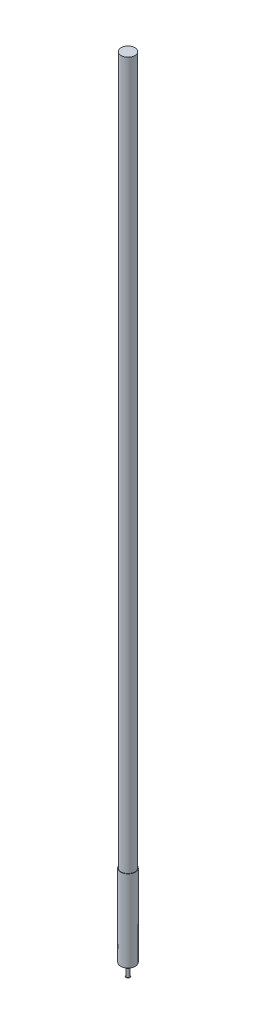
from build123d import *


with BuildPart() as part:
    # Sketch2 → Revolve1 (revolve)
    with BuildSketch(Plane(origin=(0, 0, 0), x_dir=(0, 0, -1), z_dir=(1, 0, 0)), mode=Mode.PRIVATE) as revolve1_sk:
        with BuildLine():
            Line((0.925, -4.438709677), (0.925, 5.95))
            Line((0.925, 5.95), (0.875, 5.95))
            Line((0.875, 5.95), (0.875, 95.95))
            Line((0.875, 95.95), (0, 95.95))
            Line((0, 95.95), (0, -6.1))
            ThreePointArc((0, -6.1), (0.13462912, -6.0740728), (0.25, -6))
            Line((0.25, -6), (0.2, -6))
            Line((0.2, -6), (0.2, -5))
            Line((0.2, -5), (0.925, -4.438709677))
        make_face()
    revolve(revolve1_sk.sketch.rotate(Axis((0, 105.424070968, 0), (0, -1, 0)), 180), axis=Axis((0, 105.424070968, 0), (0, -1, 0)))


solid = part.part
